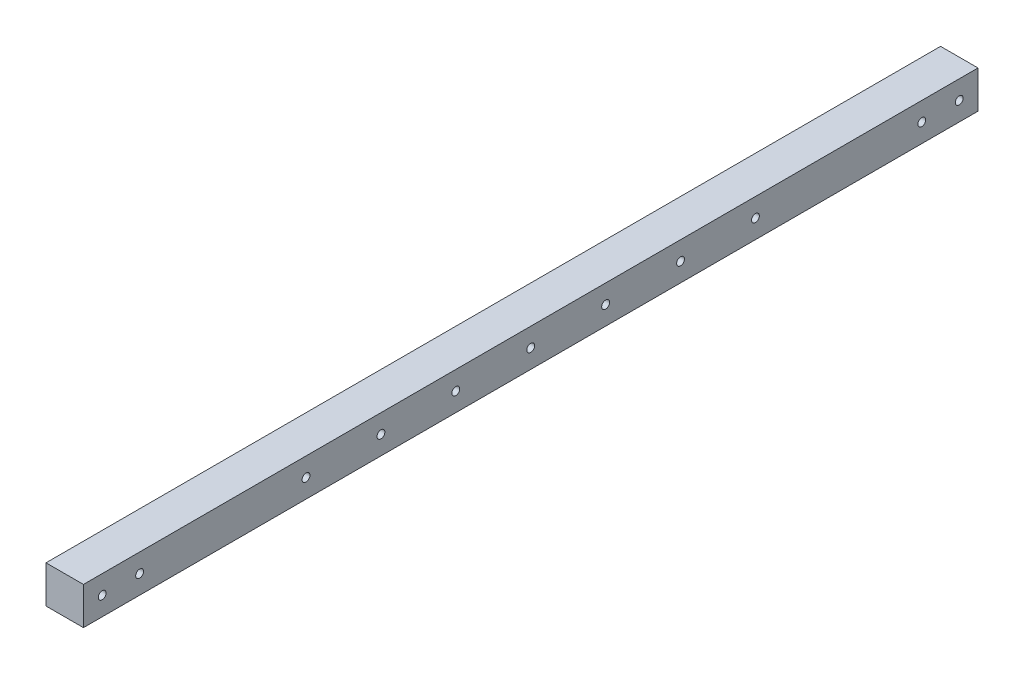
from build123d import *

# Parameters (mm, degrees)
SKETCH_1_W          = 20
SKETCH_1_H          = 20
EXTRUDE_1_DEPTH     = 477.69
SKETCH_2_R          = 2.1
CUT_EXTRUDE_2_DEPTH = 479.213065589
SKETCH_3_R          = 2.1
CUT_EXTRUDE_3_DEPTH = 479.213065589


with BuildPart() as part:
    # 草图1 → 凸台-拉伸1 (new body)
    with BuildSketch(Plane.XY):
        Rectangle(SKETCH_1_W, SKETCH_1_H)
    extrude(amount=EXTRUDE_1_DEPTH)

    # 草图2 → 切除-拉伸2 (cut, through all)
    with BuildSketch(Plane(origin=(10, 0, 0), x_dir=(0, 0, -1), z_dir=(1, 0, 0))):
        with Locations(Location((-467.69, 0, 0), (0, 0, 90))):
            Circle(SKETCH_2_R)
        with Locations(Location((-447.69, 0, 0), (0, 0, 90))):
            Circle(SKETCH_2_R)
        with Locations(Location((-10, 0, 0), (0, 0, 270))):
            Circle(SKETCH_2_R)
        with Locations(Location((-30, 0, 0), (0, 0, 270))):
            Circle(SKETCH_2_R)
    extrude(amount=-CUT_EXTRUDE_2_DEPTH, mode=Mode.SUBTRACT)

    # 草图3 → 切除-拉伸3 (cut, through all)
    with BuildSketch(Plane(origin=(10, 0, 0), x_dir=(0, 0, -1), z_dir=(1, 0, 0))):
        with Locations(Location((-238.845, 0, 0), (0, 0, 90))):
            Circle(SKETCH_3_R)
        with Locations(Location((-198.845, 0, 0), (0, 0, 90))):
            Circle(SKETCH_3_R)
        with Locations(Location((-158.845, 0, 0), (0, 0, 90))):
            Circle(SKETCH_3_R)
        with Locations(Location((-118.845, 0, 0), (0, 0, 90))):
            Circle(SKETCH_3_R)
        with Locations(Location((-358.845, 0, 0), (0, 0, 270))):
            Circle(SKETCH_3_R)
        with Locations(Location((-318.845, 0, 0), (0, 0, 270))):
            Circle(SKETCH_3_R)
        with Locations(Location((-278.845, 0, 0), (0, 0, 270))):
            Circle(SKETCH_3_R)
    extrude(amount=-CUT_EXTRUDE_3_DEPTH, mode=Mode.SUBTRACT)


solid = part.part
